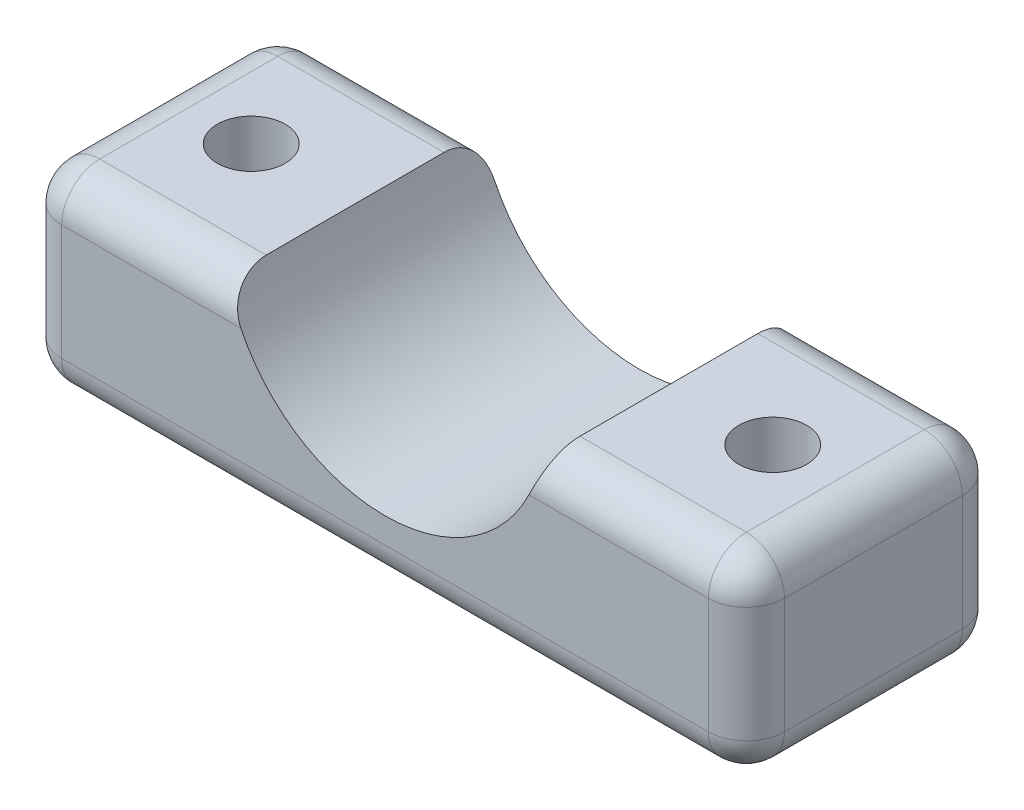
from build123d import *

# Parameters (mm, degrees)
BOSS_EXTRUDE1_DEPTH = 12.7
SKETCH2_R           = 3.3909
CUT_EXTRUDE1_DEPTH  = 45.343964598
SKETCH3_W           = 72.263
SKETCH3_H           = 7.175826556
CUT_EXTRUDE2_DEPTH  = 50.500072689
CUT_EXTRUDE3_DEPTH  = 4.07162
FILLET3_R           = 3.81


with BuildPart() as part:
    # Sketch1 → Boss-Extrude1 (new, symmetric)
    with BuildSketch(Plane.XY):
        with BuildLine():
            Line((16.002, 22.352), (36.1315, 22.352))
            Line((36.1315, 22.352), (36.1315, 0))
            Line((36.1315, 0), (-36.1315, 0))
            Line((-36.1315, 0), (-36.1315, 22.352))
            Line((-36.1315, 22.352), (-16.002, 22.352))
            ThreePointArc((-16.002, 22.352), (0, 6.35), (16.002, 22.352))
        make_face()
    extrude(amount=BOSS_EXTRUDE1_DEPTH, both=True)

    # Sketch2 → Cut-Extrude1 (cut, through all)
    with BuildSketch(Plane(origin=(0, 22.352, 0), x_dir=(1, 0, 0), z_dir=(0, 1, 0))):
        with Locations(Location((-26.06675, 0, 0), (0, 0, 270))):
            Circle(SKETCH2_R)
        with Locations(Location((26.06675, 0, 0), (0, 0, 90))):
            Circle(SKETCH2_R)
    extrude(amount=-CUT_EXTRUDE1_DEPTH, mode=Mode.SUBTRACT)

    # Sketch3 → Cut-Extrude2 (cut, through all)
    with BuildSketch(Plane.XY.offset(12.7)):
        with Locations((0, 22.764913278)):
            Rectangle(SKETCH3_W, SKETCH3_H)
    extrude(amount=-CUT_EXTRUDE2_DEPTH, mode=Mode.SUBTRACT)

    # Sketch6 → Cut-Extrude3 (cut)
    with BuildSketch(Plane.XZ):
        Polygon((-26.06675, -6.562451835), (-20.3835, -3.281225917), (-20.3835, 3.281225917), (-26.06675, 6.562451835), (-31.75, 3.281225917), (-31.75, -3.281225917), align=None)
        Polygon((26.06675, 6.562451835), (20.3835, 3.281225917), (20.3835, -3.281225917), (26.06675, -6.562451835), (31.75, -3.281225917), (31.75, 3.281225917), align=None)
    extrude(amount=-CUT_EXTRUDE3_DEPTH, mode=Mode.SUBTRACT)

    # Fillet3
    fillet3_edges = [part.edges().sort_by_distance(p)[0] for p in [
        (36.1315, 9.5885, 12.7),
        (36.1315, 0, 0),
        (-36.1315, 0, 0),
        (-36.1315, 9.5885, -12.7),
        (-36.1315, 9.5885, 12.7),
        (25.907678637, 19.177, 12.7),
        (-25.907678637, 19.177, 12.7),
        (-36.1315, 19.177, 0),
        (-25.907678637, 19.177, -12.7),
        (25.907678637, 19.177, -12.7),
        (36.1315, 19.177, 0),
        (0, 0, 12.7),
        (36.1315, 9.5885, -12.7),
        (0, 0, -12.7),
    ]]
    fillet(fillet3_edges, radius=FILLET3_R)


solid = part.part
